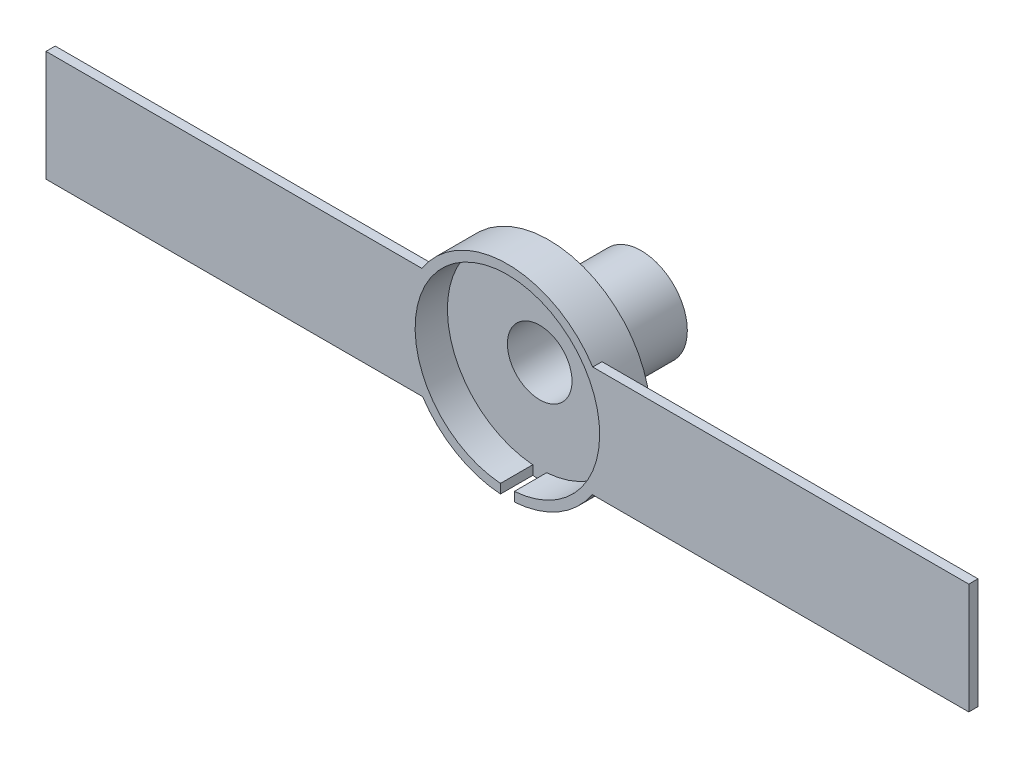
from build123d import *

# Parameters (mm, degrees)
ESBO_O1_R                     = 5
ESBO_O1_R_2                   = 3.5
RESSALTO_EXTRUS_O1_DEPTH      = 10
ESBO_O2_R                     = 11
ESBO_O2_R_2                   = 3.5
RESSALTO_EXTRUS_O2_DEPTH      = 1
ESBO_O3_R                     = 11
ESBO_O3_R_2                   = 10
RESSALTO_EXTRUS_O3_DEPTH      = 3.5
CORTE_EXTRUS_O1_REACH         = 23.266
CORTE_EXTRUS_O1_END_RADIUS    = 11
ESBO_O4_W                     = 1.5
ESBO_O4_H                     = 3.5
RESSALTO_EXTRUS_O4_REACH      = 65.657
RESSALTO_EXTRUS_O4_END_RADIUS = 11
ESBO_O8_W                     = 1
ESBO_O8_H                     = 12


with BuildPart() as part:
    # Esboço1 → Ressalto-extrusão1 (new body)
    with BuildSketch(Plane.XY):
        Circle(ESBO_O1_R)
        Circle(ESBO_O1_R_2, mode=Mode.SUBTRACT)
    extrude(amount=RESSALTO_EXTRUS_O1_DEPTH)

    # Esboço2 → Ressalto-extrusão2 (add)
    with BuildSketch(Plane.XY.offset(10)):
        Circle(ESBO_O2_R)
        Circle(ESBO_O2_R_2, mode=Mode.SUBTRACT)
    extrude(amount=RESSALTO_EXTRUS_O2_DEPTH)

    # Esboço3 → Ressalto-extrusão3 (add)
    with BuildSketch(Plane.XY.offset(11)):
        Circle(ESBO_O3_R)
        Circle(ESBO_O3_R_2, mode=Mode.SUBTRACT)
    extrude(amount=RESSALTO_EXTRUS_O3_DEPTH)

    # Corte-extrusão1: up to this cylinder (the profile starts inside it)
    corte_extrus_o1_end = Plane(origin=(0, 0, 12.75), z_dir=(0, 0, -1)) * Cylinder(CORTE_EXTRUS_O1_END_RADIUS, 69.532, mode=Mode.PRIVATE)
    # Esboço4 → Corte-extrusão1 (cut, up to the surface)
    with BuildSketch(Plane(origin=(0, 0, 0), x_dir=(1, 0, 0), z_dir=(0, 1, 0)), mode=Mode.PRIVATE) as corte_extrus_o1_sk1:
        with Locations((0, -12.75)):
            Rectangle(ESBO_O4_W, ESBO_O4_H)
    corte_extrus_o1_tool1 = extrude(corte_extrus_o1_sk1.sketch, amount=-CORTE_EXTRUS_O1_REACH, mode=Mode.PRIVATE) & corte_extrus_o1_end
    add(corte_extrus_o1_tool1.solids().sort_by_distance((0, 0, 12.75))[0], mode=Mode.SUBTRACT)

    # Ressalto-extrusão4: up to this cylinder (the profile starts outside it)
    ressalto_extrus_o4_end = Plane(origin=(0, 0, 14), z_dir=(0, 0, -1)) * Cylinder(RESSALTO_EXTRUS_O4_END_RADIUS, 154.314, mode=Mode.PRIVATE)
    # Esboço8 → Ressalto-extrusão4 (add, up to the surface)
    with BuildSketch(Plane(origin=(50, 0, 0), x_dir=(0, 0, -1), z_dir=(1, 0, 0)), mode=Mode.PRIVATE) as ressalto_extrus_o4_sk1:
        with Locations((-14, -0.050414446)):
            Rectangle(ESBO_O8_W, ESBO_O8_H)
    ressalto_extrus_o4_tool1 = extrude(ressalto_extrus_o4_sk1.sketch, amount=-RESSALTO_EXTRUS_O4_REACH, mode=Mode.PRIVATE) - ressalto_extrus_o4_end
    ressalto_extrus_o4 = ressalto_extrus_o4_tool1.solids().sort_by_distance((50, -0.050414, 14))[0]
    add(ressalto_extrus_o4)

    # Espelhar1: Ressalto-extrusão4 across plane
    add(ressalto_extrus_o4.mirror(Plane(origin=(0, 0, 0), x_dir=(0, 0, 1), z_dir=(1, 0, 0))))


solid = part.part
